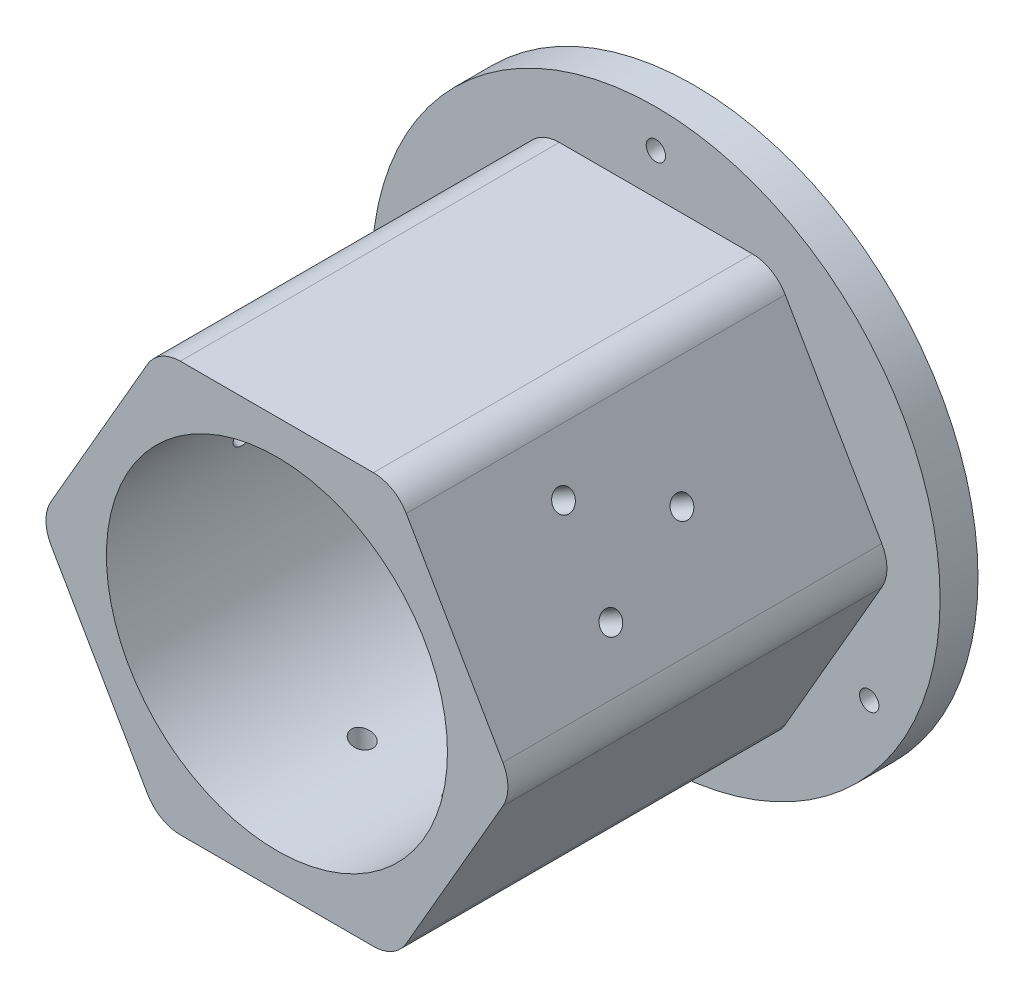
from build123d import *

# Parameters (mm, degrees)
SKETCH1_R               = 75
BOSS_EXTRUDE1_DEPTH     = 10
BOSS_EXTRUDE2_DEPTH     = 100
SKETCH4_R               = 45
CUT_EXTRUDE1_DEPTH      = 100
CUT_EXTRUDE2_REACH      = 187.469
CUT_EXTRUDE2_END_RADIUS = 45
SKETCH5_R               = 2.8
CIRPATTERN1_COUNT       = 3
SKETCH7_R               = 2.55
CUT_EXTRUDE3_DEPTH      = 10


with BuildPart() as part:
    # Sketch1 → Boss-Extrude1 (new body)
    with BuildSketch(Plane.XY):
        Circle(SKETCH1_R)
    extrude(amount=BOSS_EXTRUDE1_DEPTH)

    # Sketch2 → Boss-Extrude2 (add)
    with BuildSketch(Plane.XY.offset(10)):
        with BuildLine():
            Line((59.613248654, 5), (34.136751346, 49.126587737))
            ThreePointArc((34.136751346, 49.126587737), (30.476497308, 52.786841774), (25.476497308, 54.126587737))
            Line((25.476497308, 54.126587737), (-25.476497308, 54.126587737))
            ThreePointArc((-25.476497308, 54.126587737), (-30.476497308, 52.786841774), (-34.136751346, 49.126587737))
            Line((-34.136751346, 49.126587737), (-59.613248654, 5))
            ThreePointArc((-59.613248654, 5), (-60.952994616, 0), (-59.613248654, -5))
            Line((-59.613248654, -5), (-34.136751346, -49.126587737))
            ThreePointArc((-34.136751346, -49.126587737), (-30.476497308, -52.786841774), (-25.476497308, -54.126587737))
            Line((-25.476497308, -54.126587737), (25.476497308, -54.126587737))
            ThreePointArc((25.476497308, -54.126587737), (30.476497308, -52.786841774), (34.136751346, -49.126587737))
            Line((34.136751346, -49.126587737), (59.613248654, -5))
            ThreePointArc((59.613248654, -5), (60.952994616, 0), (59.613248654, 5))
        make_face()
    extrude(amount=BOSS_EXTRUDE2_DEPTH)

    # Sketch4 → Cut-Extrude1 (cut)
    with BuildSketch(Plane.XY.offset(110)):
        Circle(SKETCH4_R)
    extrude(amount=-CUT_EXTRUDE1_DEPTH, mode=Mode.SUBTRACT)

    # Cut-Extrude2: up to this cylinder (the profile starts outside it)
    cut_extrude2_end = Plane(origin=(0, 0, 62.5), z_dir=(0, 0, 1)) * Cylinder(CUT_EXTRUDE2_END_RADIUS, 490.938, mode=Mode.PRIVATE)
    # Sketch5 → Cut-Extrude2 (cut, up to the surface)
    with BuildSketch(Plane.XZ.offset(54.126587737), mode=Mode.PRIVATE) as cut_extrude2_sk1:
        with Locations((0, 50)):
            Circle(SKETCH5_R)
    cut_extrude2_tool1 = extrude(cut_extrude2_sk1.sketch, amount=-CUT_EXTRUDE2_REACH, mode=Mode.PRIVATE) - cut_extrude2_end
    # Sketch5 → Cut-Extrude2 (cut, up to the surface)
    with BuildSketch(Plane.XZ.offset(54.126587737), mode=Mode.PRIVATE) as cut_extrude2_sk2:
        with Locations((-12.5, 75)):
            Circle(SKETCH5_R)
    cut_extrude2_tool2 = extrude(cut_extrude2_sk2.sketch, amount=-CUT_EXTRUDE2_REACH, mode=Mode.PRIVATE) - cut_extrude2_end
    # Sketch5 → Cut-Extrude2 (cut, up to the surface)
    with BuildSketch(Plane.XZ.offset(54.126587737), mode=Mode.PRIVATE) as cut_extrude2_sk3:
        with Locations((12.5, 75)):
            Circle(SKETCH5_R)
    cut_extrude2_tool3 = extrude(cut_extrude2_sk3.sketch, amount=-CUT_EXTRUDE2_REACH, mode=Mode.PRIVATE) - cut_extrude2_end
    cut_extrude2 = cut_extrude2_tool1.solids().sort_by_distance((0, -54.126588, 50))[0] + cut_extrude2_tool2.solids().sort_by_distance((-12.5, -54.126588, 75))[0] + cut_extrude2_tool3.solids().sort_by_distance((12.5, -54.126588, 75))[0]
    add(cut_extrude2, mode=Mode.SUBTRACT)

    # CirPattern1: Cut-Extrude2 ×3 about axis
    cirpattern1_axis = Axis((0, 0, -117.279220614), (0, 0, 1))
    for i in range(1, CIRPATTERN1_COUNT):
        add(cut_extrude2.rotate(cirpattern1_axis, i * 360 / CIRPATTERN1_COUNT), mode=Mode.SUBTRACT)

    # Sketch7 → Cut-Extrude3 (cut)
    with BuildSketch(Plane.XY.offset(10)):
        with Locations((0, 65)):
            Circle(SKETCH7_R)
        with Locations((56.291651246, -32.5)):
            Circle(SKETCH7_R)
        with Locations((-56.291651246, -32.5)):
            Circle(SKETCH7_R)
    extrude(amount=-CUT_EXTRUDE3_DEPTH, mode=Mode.SUBTRACT)


solid = part.part
